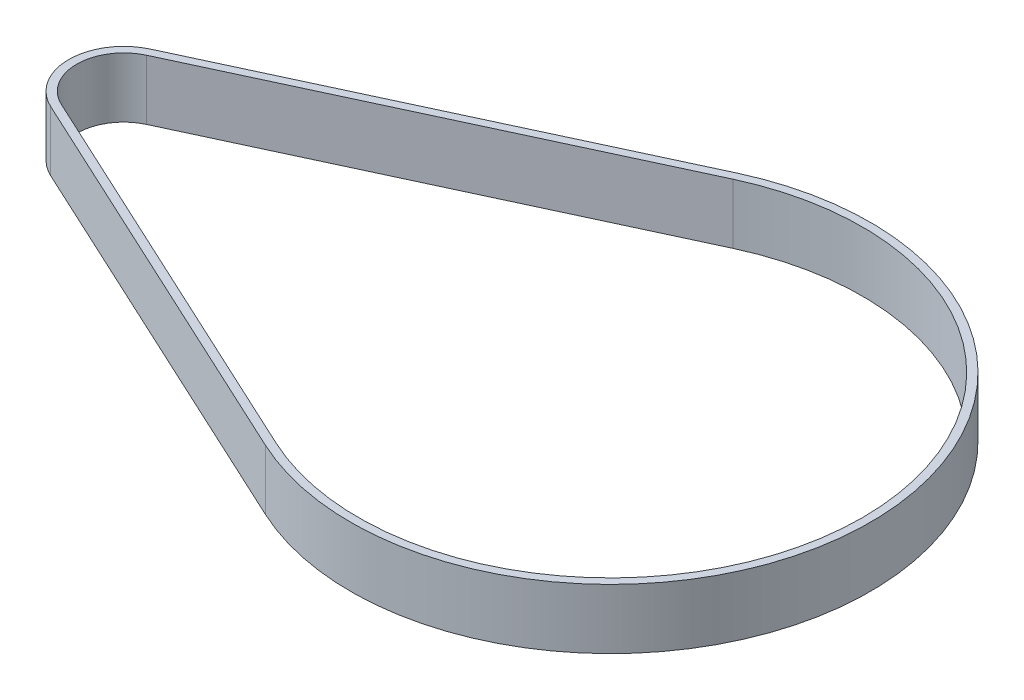
from build123d import *

# Parameters (mm, degrees)
BOSS_EXTRUDE1_DEPTH = 6


with BuildPart() as part:
    # Sketch1 → Boss-Extrude1 (new body)
    with BuildSketch(Plane(origin=(0, 0, 0), x_dir=(1, 0, 0), z_dir=(0, 1, 0))):
        with BuildLine():
            Line((-51.040135967, 4.989002451), (-10.948488456, 23.593446135))
            ThreePointArc((-10.948488456, 23.593446135), (26.01, 0), (-10.948488456, -23.593446135))
            Line((-10.948488456, -23.593446135), (-51.040135967, -4.989002451))
            ThreePointArc((-51.040135967, -4.989002451), (-54.225, 0), (-51.040135967, 4.989002451))
        make_face()
        with BuildLine():
            Line((-50.703388917, 4.263329367), (-10.611741406, 22.867773052))
            ThreePointArc((-10.611741406, 22.867773052), (25.21, 0), (-10.611741406, -22.867773052))
            Line((-10.611741406, -22.867773052), (-50.703388917, -4.263329367))
            ThreePointArc((-50.703388917, -4.263329367), (-53.425, 0), (-50.703388917, 4.263329367))
        make_face(mode=Mode.SUBTRACT)
    extrude(amount=BOSS_EXTRUDE1_DEPTH)


solid = part.part
